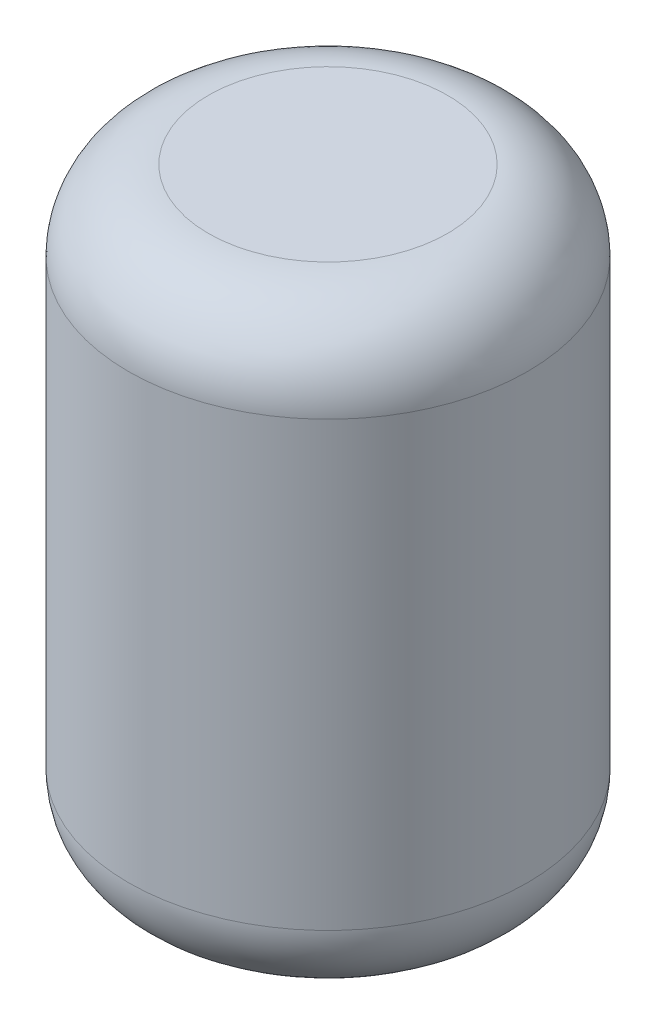
from build123d import *

# Parameters (mm, degrees)
SKETCH1_R           = 100
SKETCH1_R_2         = 98
BOSS_EXTRUDE1_DEPTH = 300
SKETCH2_R           = 100
BOSS_EXTRUDE2_DEPTH = 2
SKETCH4_R           = 100
BOSS_EXTRUDE3_DEPTH = 2
FILLET1_R           = 40


with BuildPart() as part:
    # Sketch1 → Boss-Extrude1 (new body)
    with BuildSketch(Plane(origin=(0, 0, 0), x_dir=(1, 0, 0), z_dir=(0, 1, 0))):
        with Locations(Location((0, 0, 0), (0, 0, 270))):
            Circle(SKETCH1_R)
        with Locations(Location((0, 0, 0), (0, 0, 270))):
            Circle(SKETCH1_R_2, mode=Mode.SUBTRACT)
    extrude(amount=BOSS_EXTRUDE1_DEPTH)

    # Sketch2 → Boss-Extrude2 (add)
    with BuildSketch(Plane.XZ):
        with Locations(Location((0, 0, 0), (0, 0, 90))):
            Circle(SKETCH2_R)
    extrude(amount=-BOSS_EXTRUDE2_DEPTH)

    # Sketch4 → Boss-Extrude3 (add)
    with BuildSketch(Plane(origin=(0, 300, 0), x_dir=(1, 0, 0), z_dir=(0, 1, 0))):
        with Locations(Location((0, 0, 0), (0, 0, 270))):
            Circle(SKETCH4_R)
    extrude(amount=BOSS_EXTRUDE3_DEPTH)

    # Fillet1
    fillet1_edges = [part.edges().sort_by_distance(p)[0] for p in [
        (0, 2, -98),
        (0, 300, -98),
        (0, 302, -100),
        (0, 0, -100),
    ]]
    fillet(fillet1_edges, radius=FILLET1_R)


solid = part.part
